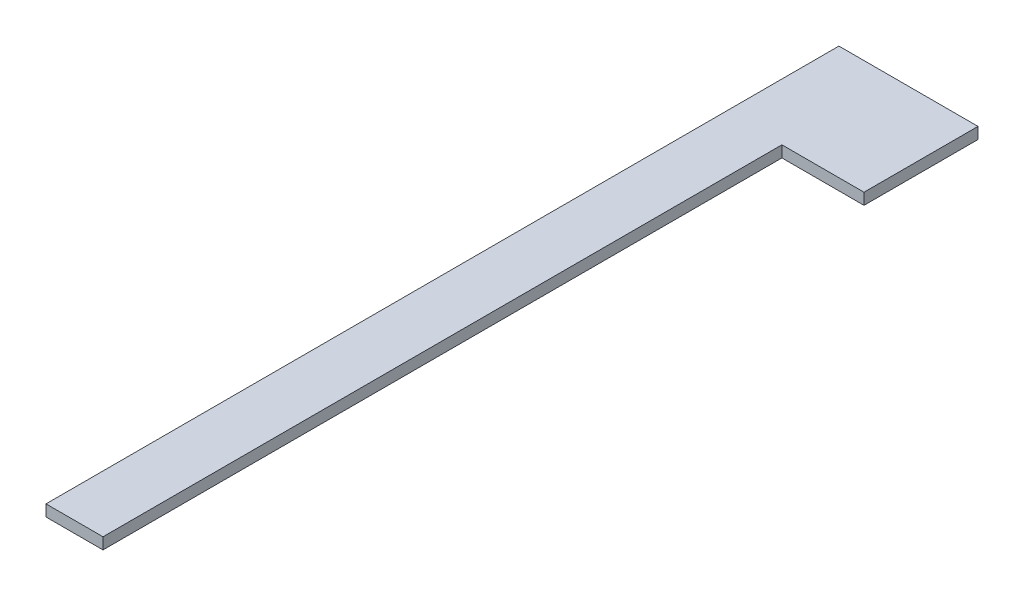
from build123d import *

# Parameters (mm, degrees)
SKETCH2_W           = 5
SKETCH2_H           = 59.55
BOSS_EXTRUDE2_DEPTH = 1


with BuildPart() as part:
    # Sketch2 → Boss-Extrude2 (new body)
    with BuildSketch(Plane(origin=(0, 0, 0), x_dir=(1, 0, 0), z_dir=(0, 1, 0))):
        with Locations((-7.544578313, -61.702409639)):
            Rectangle(SKETCH2_W, SKETCH2_H)
        Polygon((-10.044578313, -21.927409639), (-10.044578313, -31.927409639), (-5.044578313, -31.927409639), (2.155421687, -31.927409639), (2.155421687, -21.927409639), align=None)
    extrude(amount=BOSS_EXTRUDE2_DEPTH)


solid = part.part
